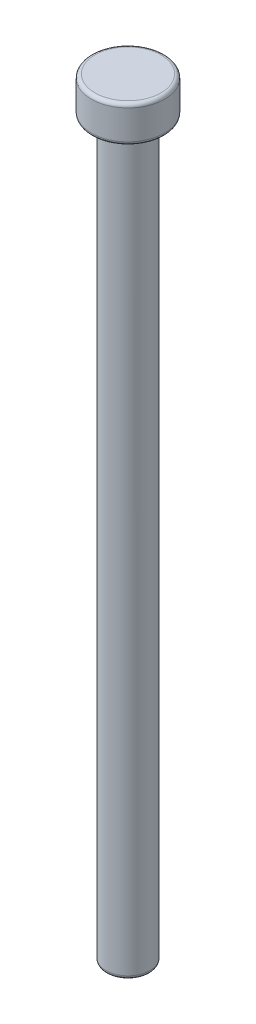
from build123d import *

# Parameters (mm, degrees)
SKETCH_1_R      = 5
EXTRUDE_1_DEPTH = 5
SKETCH_2_R      = 3
EXTRUDE_2_DEPTH = 100
FILLET_1_R      = 0.5


with BuildPart() as part:
    # 草圖1 → 伸長1 (new body)
    with BuildSketch(Plane(origin=(0, 0, 0), x_dir=(1, 0, 0), z_dir=(0, 1, 0))):
        with Locations(Location((0, 0, 0), (0, 0, 270))):
            Circle(SKETCH_1_R)
    extrude(amount=EXTRUDE_1_DEPTH)

    # 草圖2 → 伸長2 (add)
    with BuildSketch(Plane.XZ):
        with Locations(Location((0, 0, 0), (0, 0, 90))):
            Circle(SKETCH_2_R)
    extrude(amount=EXTRUDE_2_DEPTH)

    # 圓角1
    fillet_1_edges = [part.edges().sort_by_distance(p)[0] for p in [
        (0, 0, -5),
        (0, 5, -5),
        (0, 0, -3),
        (0, -100, -3),
    ]]
    fillet(fillet_1_edges, radius=FILLET_1_R)


solid = part.part
